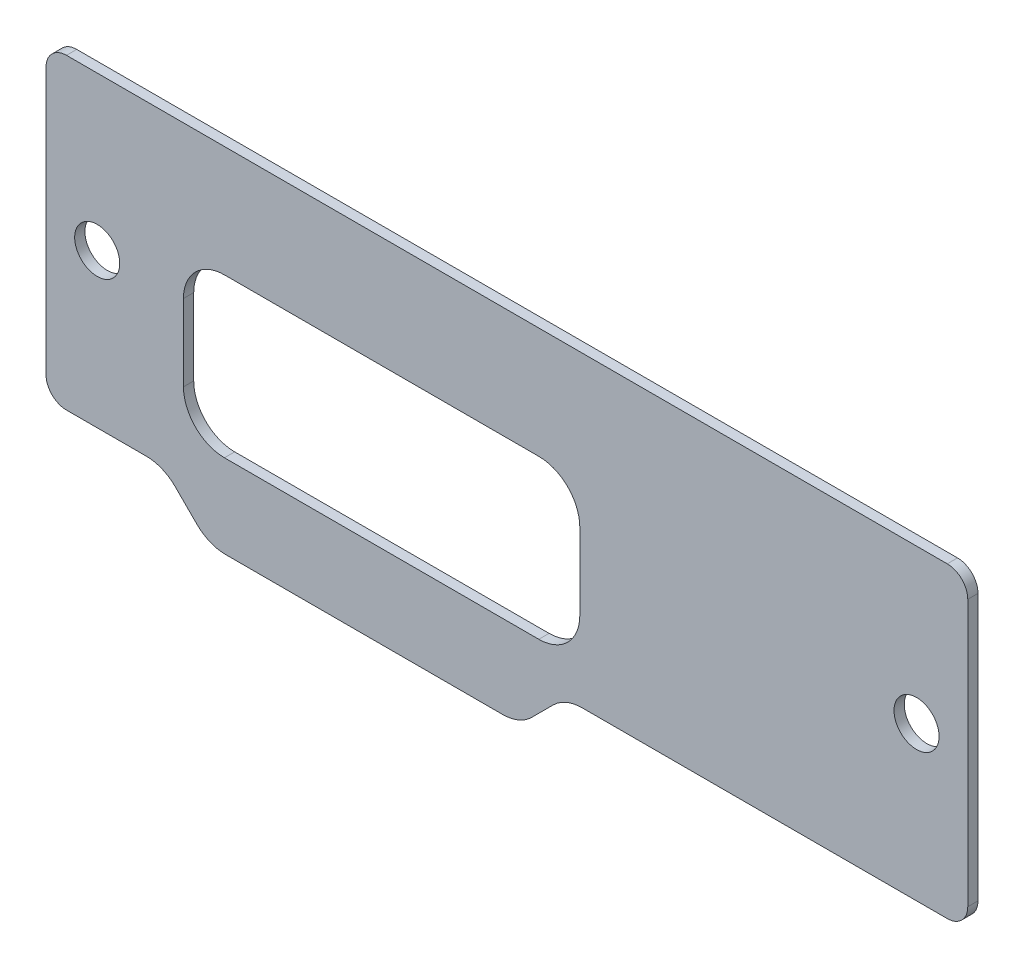
from build123d import *

# Parameters (mm, degrees)
SKETCH_1_W          = 45
SKETCH_1_H          = 15
SKETCH_1_R          = 1.1
EXTRUDE_1_DEPTH     = 0.5
SKETCH_2_W          = 19.349402369
SKETCH_2_H          = 7.733193781
CUT_EXTRUDE_1_DEPTH = 1.5
FILLET_2_R          = 1
FILLET_3_R          = 2
EXTRUDE_2_DEPTH     = 0.5
FILLET_4_R          = 2


with BuildPart() as part:
    # 草图1 → 凸台-拉伸1 (new body)
    with BuildSketch(Plane.XY):
        with Locations((-1.488440653, 4.336799691)):
            Rectangle(SKETCH_1_W, SKETCH_1_H)
        with Locations((-21.488440653, 4.336799691)):
            Circle(SKETCH_1_R, mode=Mode.SUBTRACT)
        with Locations((18.511559347, 4.336799691)):
            Circle(SKETCH_1_R, mode=Mode.SUBTRACT)
    extrude(amount=EXTRUDE_1_DEPTH)

    # 草图2 → 切除-拉伸1 (cut)
    with BuildSketch(Plane.XY.offset(0.5)):
        with Locations((-7.602725981, 2.54307272)):
            Rectangle(SKETCH_2_W, SKETCH_2_H)
    extrude(amount=-CUT_EXTRUDE_1_DEPTH, mode=Mode.SUBTRACT)

    # 圆角2
    fillet_2_edges = [part.edges().sort_by_distance(p)[0] for p in [
        (21.011559347, -3.163200309, 0.25),
        (-23.988440653, -3.163200309, 0.25),
        (-23.988440653, 11.836799691, 0.25),
        (21.011559347, 11.836799691, 0.25),
    ]]
    fillet(fillet_2_edges, radius=FILLET_2_R)

    # 圆角3
    fillet_3_edges = [part.edges().sort_by_distance(p)[0] for p in [
        (2.071975204, 6.40966961, 0.25),
        (2.071975204, -1.323524171, 0.25),
        (-17.277427165, -1.323524171, 0.25),
        (-17.277427165, 6.40966961, 0.25),
    ]]
    fillet(fillet_3_edges, radius=FILLET_3_R)

    # 草图3 → 凸台-拉伸2 (add)
    with BuildSketch(Plane.XY.offset(0.5)):
        Polygon((-18.839640509, -2.587666371), (-16.040814973, -5.386491907), (-0.864084954, -5.386491907), (2.88813454, -1.634272413), align=None)
    extrude(amount=-EXTRUDE_2_DEPTH)

    # 圆角4
    fillet_4_edges = [part.edges().sort_by_distance(p)[0] for p in [
        (-18.26410657, -3.163200309, 0.25),
        (1.359206644, -3.163200309, 0.25),
        (-16.040814973, -5.386491907, 0.25),
        (-0.864084954, -5.386491907, 0.25),
    ]]
    fillet(fillet_4_edges, radius=FILLET_4_R)


solid = part.part
